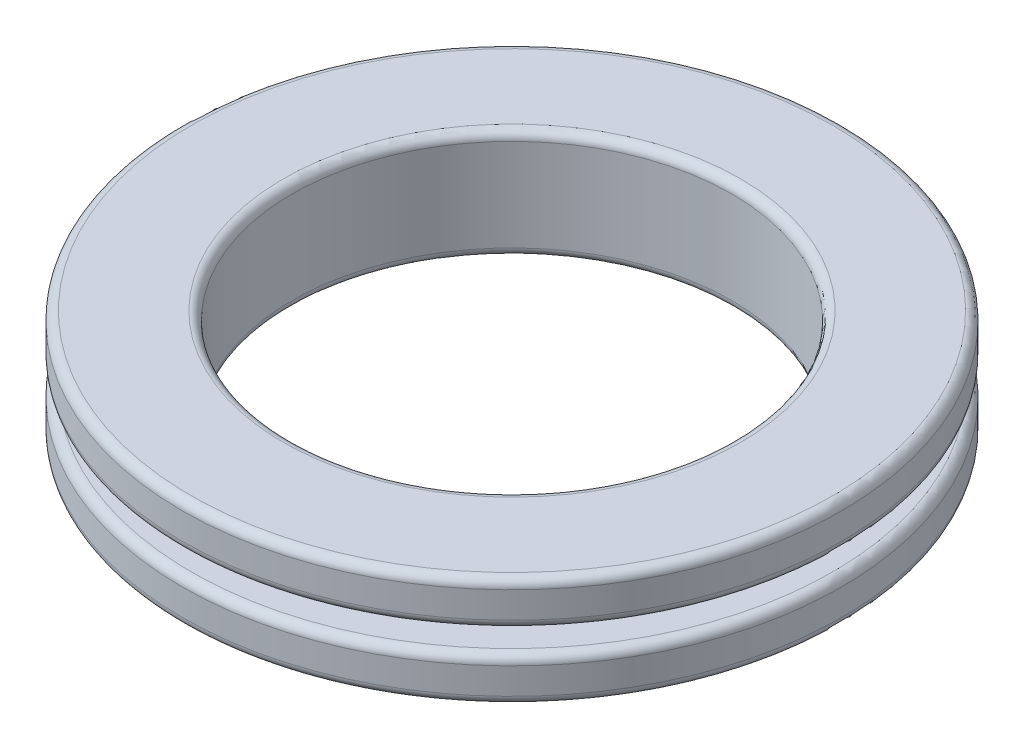
from build123d import *


with BuildPart() as part:
    # Эскиз1 → Повернуть1 (revolve)
    with BuildSketch(Plane.XY, mode=Mode.PRIVATE) as revolve_1_sk:
        with BuildLine():
            Line((20, 0.8), (20, 9.2))
            ThreePointArc((20, 9.2), (20.234314575, 9.765685425), (20.8, 10))
            Line((20.8, 10), (29.2, 10))
            ThreePointArc((29.2, 10), (29.765685425, 9.765685425), (30, 9.2))
            Line((30, 9.2), (30, 6.8))
            ThreePointArc((30, 6.8), (29.765685425, 6.234314575), (29.2, 6))
            Line((29.2, 6), (25.8, 6))
            ThreePointArc((25.8, 6), (25.234314575, 5.765685425), (25, 5.2))
            Line((25, 5.2), (25, 4.8))
            ThreePointArc((25, 4.8), (25.234314575, 4.234314575), (25.8, 4))
            Line((25.8, 4), (29.2, 4))
            ThreePointArc((29.2, 4), (29.765685425, 3.765685425), (30, 3.2))
            Line((30, 3.2), (30, 0.8))
            ThreePointArc((30, 0.8), (29.765685425, 0.234314575), (29.2, 0))
            Line((29.2, 0), (20.8, 0))
            ThreePointArc((20.8, 0), (20.234314575, 0.234314575), (20, 0.8))
        make_face()
    revolve(revolve_1_sk.sketch.rotate(Axis((0, 0, 0), (0, 1, 0)), 90), axis=Axis((0, 0, 0), (0, 1, 0)))


solid = part.part
